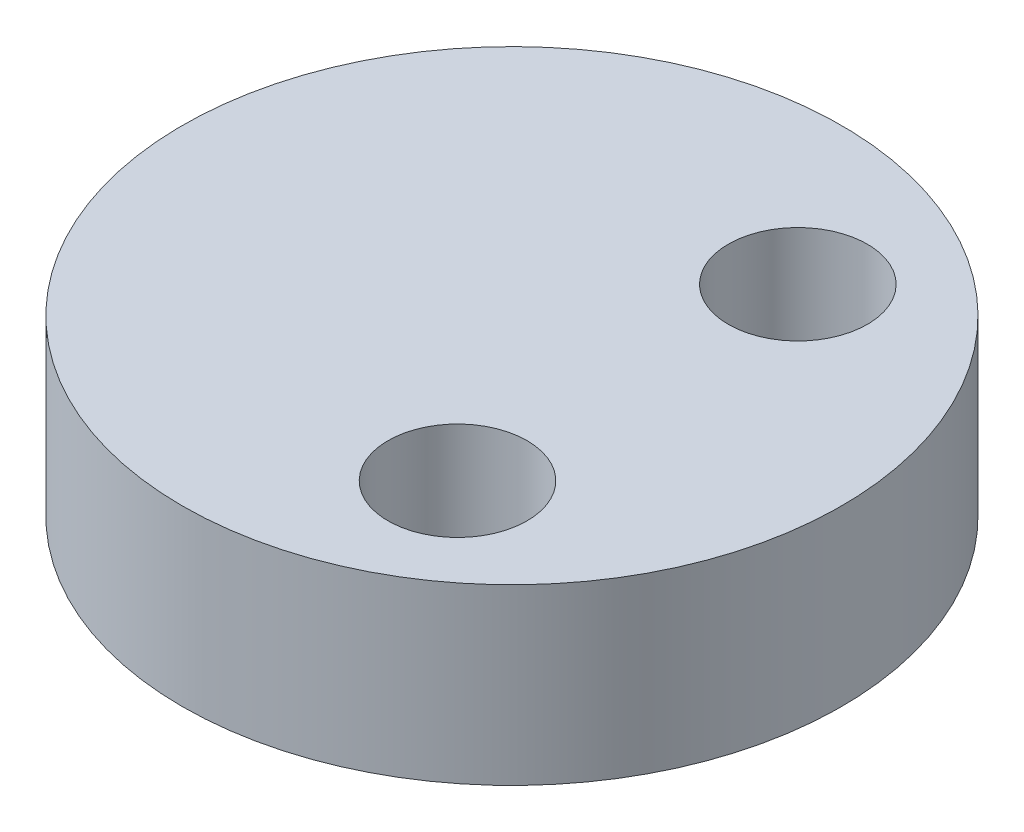
from build123d import *

# Parameters (mm, degrees)
SKETCH1_R           = 9.48
BOSS_EXTRUDE1_DEPTH = 5
SKETCH2_R           = 2
CUT_EXTRUDE1_DEPTH  = 3


with BuildPart() as part:
    # Sketch1 → Boss-Extrude1 (new body)
    with BuildSketch(Plane(origin=(0, 0, 0), x_dir=(1, 0, 0), z_dir=(0, 1, 0))):
        with Locations(Location((0, 0, 0), (0, 0, 270))):
            Circle(SKETCH1_R)
    extrude(amount=-BOSS_EXTRUDE1_DEPTH)

    # Sketch2 → Cut-Extrude1 (cut)
    with BuildSketch(Plane(origin=(0, 0, 0), x_dir=(1, 0, 0), z_dir=(0, 1, 0))):
        with Locations(Location((3.329285114, 4.894478506, 0), (0, 0, 270))):
            Circle(SKETCH2_R)
        with Locations(Location((3.329285114, -4.894478506, 0), (0, 0, 90))):
            Circle(SKETCH2_R)
    extrude(amount=-CUT_EXTRUDE1_DEPTH, mode=Mode.SUBTRACT)


solid = part.part
